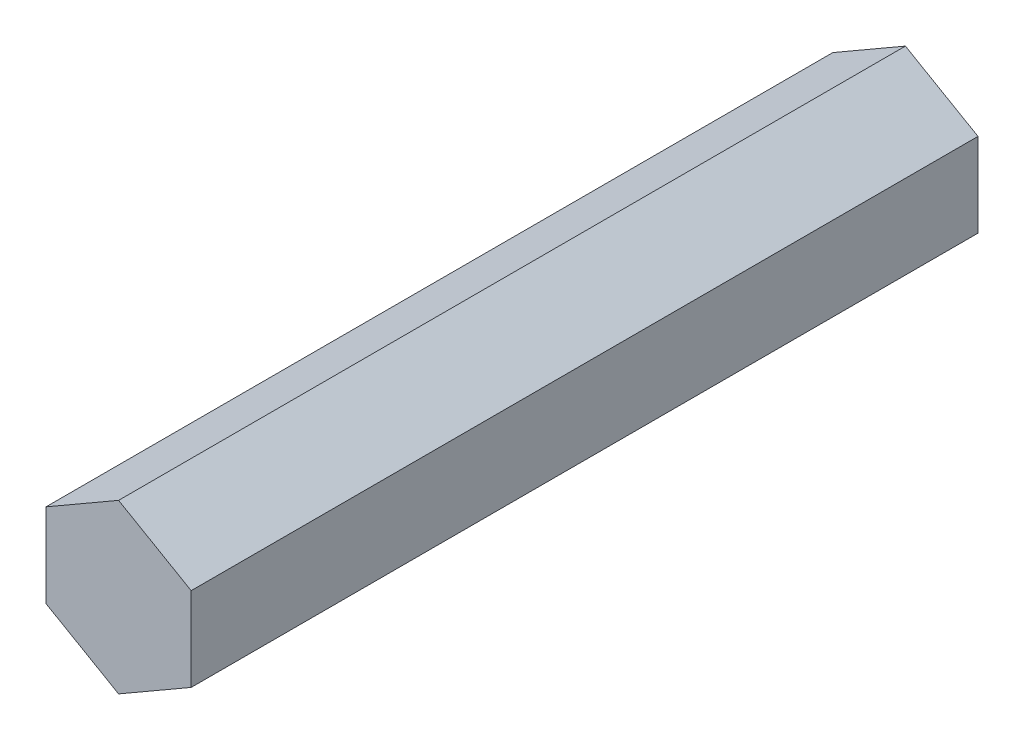
from build123d import *

# Parameters (mm, degrees)
BOSS_EXTRUDE1_DEPTH = 34.417


with BuildPart() as part:
    # Sketch1 → Boss-Extrude1 (new, symmetric)
    with BuildSketch(Plane.XY):
        Polygon((6.35, 3.666174209), (0, 7.332348419), (-6.35, 3.666174209), (-6.35, -3.666174209), (0, -7.332348419), (6.35, -3.666174209), align=None)
    extrude(amount=BOSS_EXTRUDE1_DEPTH, both=True)


solid = part.part
